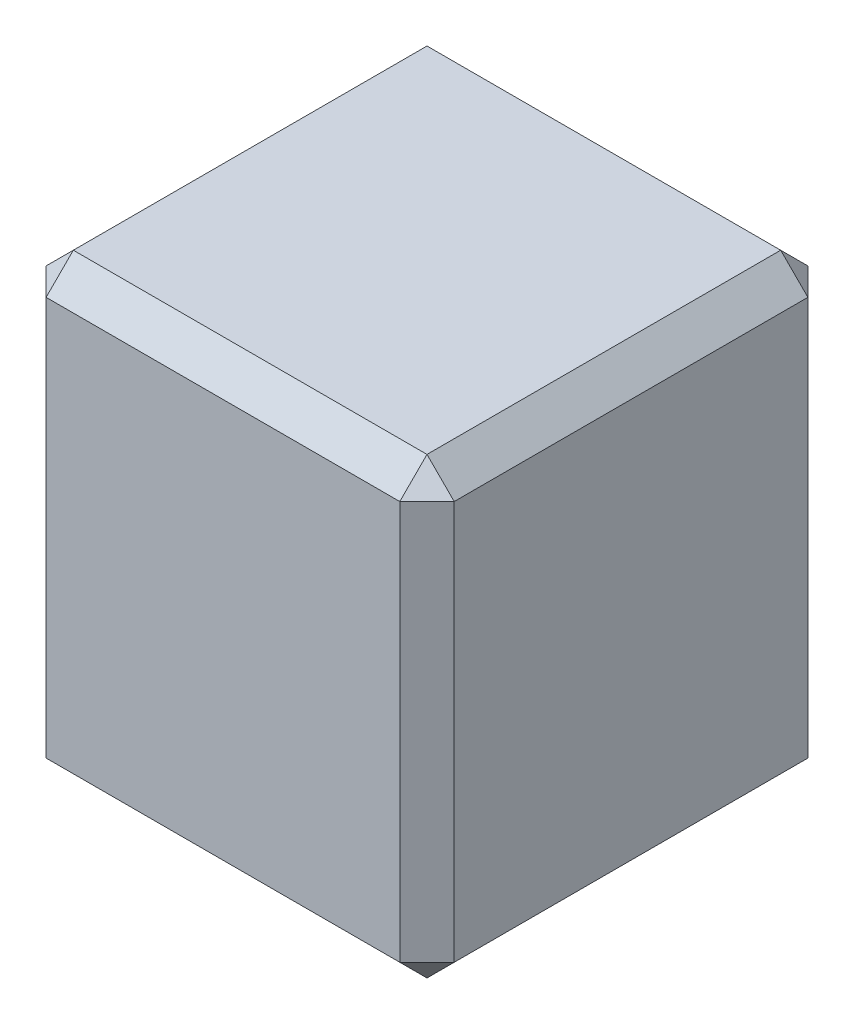
from build123d import *

# Parameters (mm, degrees)
SKETCH1_W           = 45
SKETCH1_H           = 45
BOSS_EXTRUDE1_DEPTH = 50
SKETCH2_R           = 4.15
CUT_EXTRUDE1_DEPTH  = 30
SKETCH3_R           = 4.15
CUT_EXTRUDE2_DEPTH  = 30
CHAMFER1_SIZE       = 3


with BuildPart() as part:
    # Sketch1 → Boss-Extrude1 (new body)
    with BuildSketch(Plane(origin=(0, 0, 0), x_dir=(1, 0, 0), z_dir=(0, 1, 0))):
        Rectangle(SKETCH1_W, SKETCH1_H)
    extrude(amount=BOSS_EXTRUDE1_DEPTH)

    # Sketch2 → Cut-Extrude1 (cut)
    with BuildSketch(Plane(origin=(0, 0, -22.5), x_dir=(-1, 0, 0), z_dir=(0, 0, -1))):
        with Locations((0, 12.5)):
            Circle(SKETCH2_R)
    extrude(amount=-CUT_EXTRUDE1_DEPTH, mode=Mode.SUBTRACT)

    # Sketch3 → Cut-Extrude2 (cut)
    with BuildSketch(Plane.ZY.offset(22.5)):
        with Locations((0, 37.5)):
            Circle(SKETCH3_R)
    extrude(amount=-CUT_EXTRUDE2_DEPTH, mode=Mode.SUBTRACT)

    # Chamfer1
    chamfer1_edges = [part.edges().sort_by_distance(p)[0] for p in [
        (-22.5, 50, 0),
        (0, 50, 22.5),
        (22.5, 50, 0),
        (0, 0, 22.5),
        (-22.5, 0, 0),
        (0, 0, -22.5),
        (22.5, 0, 0),
        (22.5, 25, 22.5),
        (-22.5, 25, 22.5),
        (-22.5, 25, -22.5),
        (22.5, 25, -22.5),
        (0, 50, -22.5),
    ]]
    chamfer(chamfer1_edges, length=CHAMFER1_SIZE)


solid = part.part
